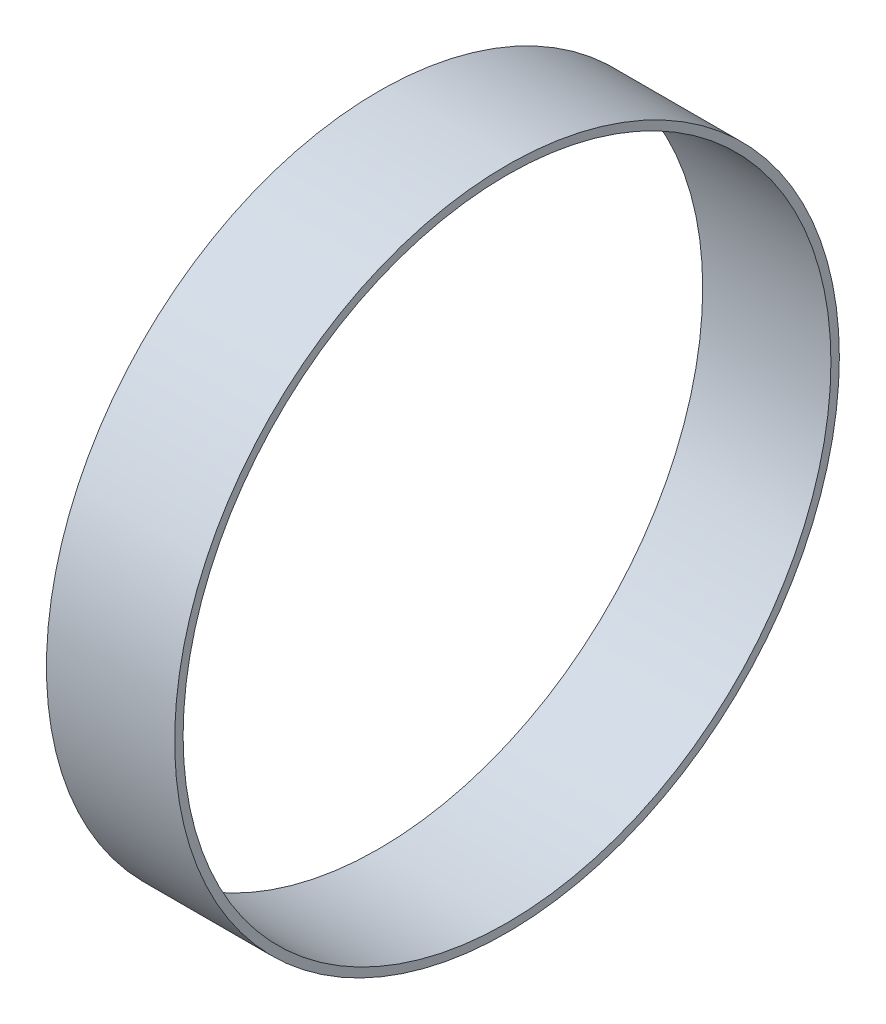
from build123d import *

# Parameters (mm, degrees)
SKETCH1_R           = 98.5
SKETCH1_R_2         = 96
BOSS_EXTRUDE1_DEPTH = 38


with BuildPart() as part:
    # Sketch1 → Boss-Extrude1 (new body)
    with BuildSketch(Plane(origin=(0, 0, 0), x_dir=(0, 0, -1), z_dir=(1, 0, 0))):
        Circle(SKETCH1_R)
        Circle(SKETCH1_R_2, mode=Mode.SUBTRACT)
    extrude(amount=BOSS_EXTRUDE1_DEPTH)


solid = part.part
